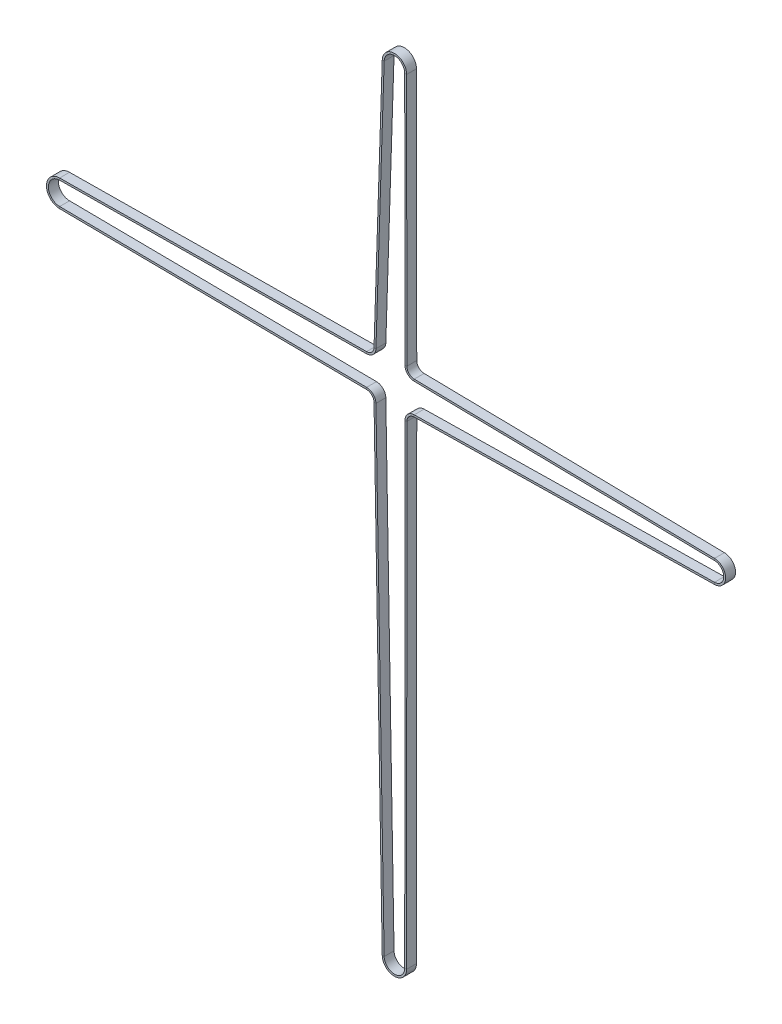
from build123d import *

# Parameters (mm, degrees)
SKETCH3_W = 1.2
SKETCH3_H = 6.2


with BuildPart() as part:
    # Sweep1: sweep along a path in Sketch2
    with BuildLine(Plane.XY) as sweep1_path:
        Line((-6.448403422, -0.111551706), (-11.600882618, 297.734761881))
        ThreePointArc((-11.600882618, 297.734761881), (-13.342957561, 301.819476981), (-17.439980035, 303.532407044))
        Line((-17.439980035, 303.532407044), (-209.956343171, 305.490953375))
        ThreePointArc((-209.956343171, 305.490953375), (-217.025815722, 312.63271234), (-209.956343171, 319.774471304))
        Line((-209.956343171, 319.774471304), (-17.439980035, 321.733017635))
        ThreePointArc((-17.439980035, 321.733017635), (-13.374840603, 323.414530272), (-11.603110065, 327.441168355))
        Line((-11.603110065, 327.441168355), (-6.445968569, 486.209379269))
        ThreePointArc((-6.445968569, 486.209379269), (0.101636768, 492.448567317), (6.449365306, 486.006134116))
        Line((6.449365306, 486.006134116), (6.600002669, 327.627100738))
        ThreePointArc((6.600002669, 327.627100738), (8.294727162, 323.494393797), (12.399704541, 321.733564874))
        Line((12.399704541, 321.733564874), (200.716608272, 318.531859805))
        ThreePointArc((200.716608272, 318.531859805), (206.516312813, 312.63271234), (200.716608272, 306.733564874))
        Line((200.716608272, 306.733564874), (12.399704541, 303.531859805))
        ThreePointArc((12.399704541, 303.531859805), (8.293806439, 301.770095054), (6.600000756, 297.635698295))
        Line((6.600000756, 297.635698295), (6.449367397, -0.003263988))
        ThreePointArc((6.449367397, -0.003263988), (0.054146005, -6.449140926), (-6.448403422, -0.111551706))
    # Sketch3 → Sweep1 (sweep)
    with BuildSketch(Plane(origin=(0, 0, 0), x_dir=(1, 0, 0), z_dir=(0, 1, 0))):
        with Locations((7.049367397, 3.1)):
            Rectangle(SKETCH3_W, SKETCH3_H)
    sweep(path=sweep1_path.line)


solid = part.part
